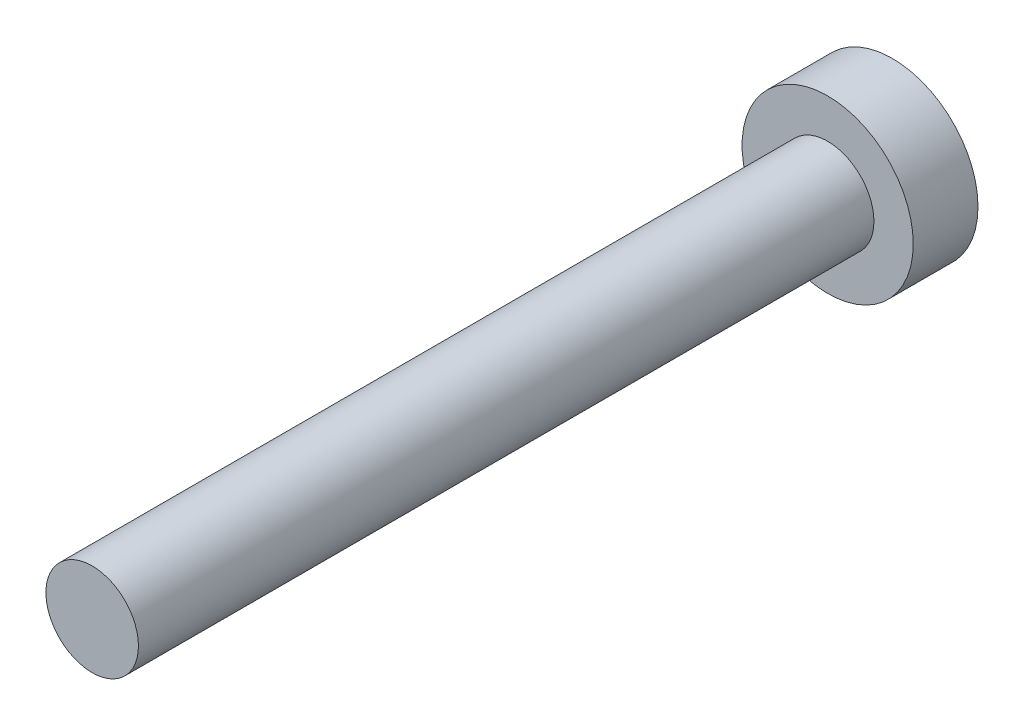
from build123d import *

# Parameters (mm, degrees)
SKETCH_1_R      = 1.85
EXTRUDE_1_DEPTH = 1.4
SKETCH_2_R      = 1
EXTRUDE_2_DEPTH = 15.9


with BuildPart() as part:
    # Эскиз1 → Бобышка-Вытянуть1 (new body)
    with BuildSketch(Plane.XY):
        Circle(SKETCH_1_R)
    extrude(amount=EXTRUDE_1_DEPTH)

    # Эскиз2 → Бобышка-Вытянуть2 (add)
    with BuildSketch(Plane.XY.offset(1.4)):
        Circle(SKETCH_2_R)
    extrude(amount=EXTRUDE_2_DEPTH)


solid = part.part
